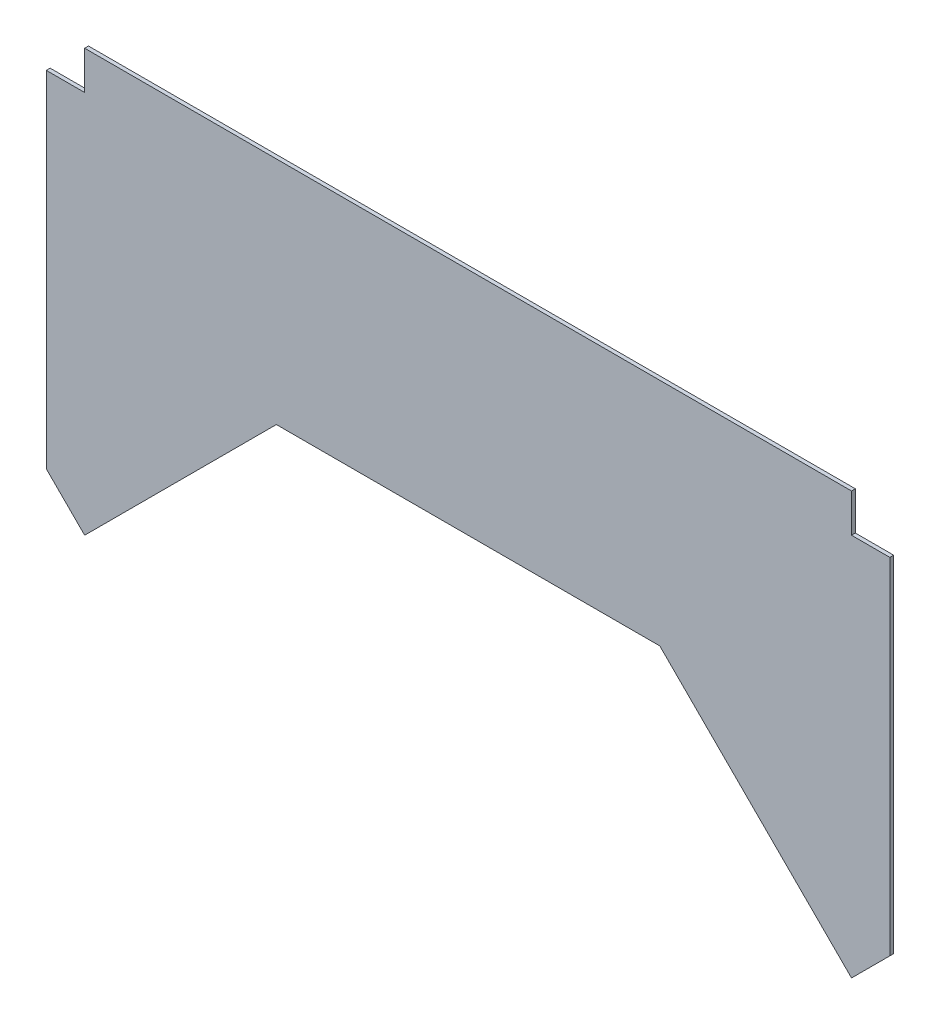
from build123d import *

# Parameters (mm, degrees)
SALIENTE_EXTRUIR1_DEPTH = 1


with BuildPart() as part:
    # Croquis1 → Saliente-Extruir1 (new body)
    with BuildSketch(Plane.XY):
        Polygon((110, 0), (100, 0), (100, 10), (-100, 10), (-100, 0), (-110, 0), (-110, -90), (-100, -100), (-50, -50), (50, -50), (100, -100), (110, -90), align=None)
    extrude(amount=SALIENTE_EXTRUIR1_DEPTH)


solid = part.part
